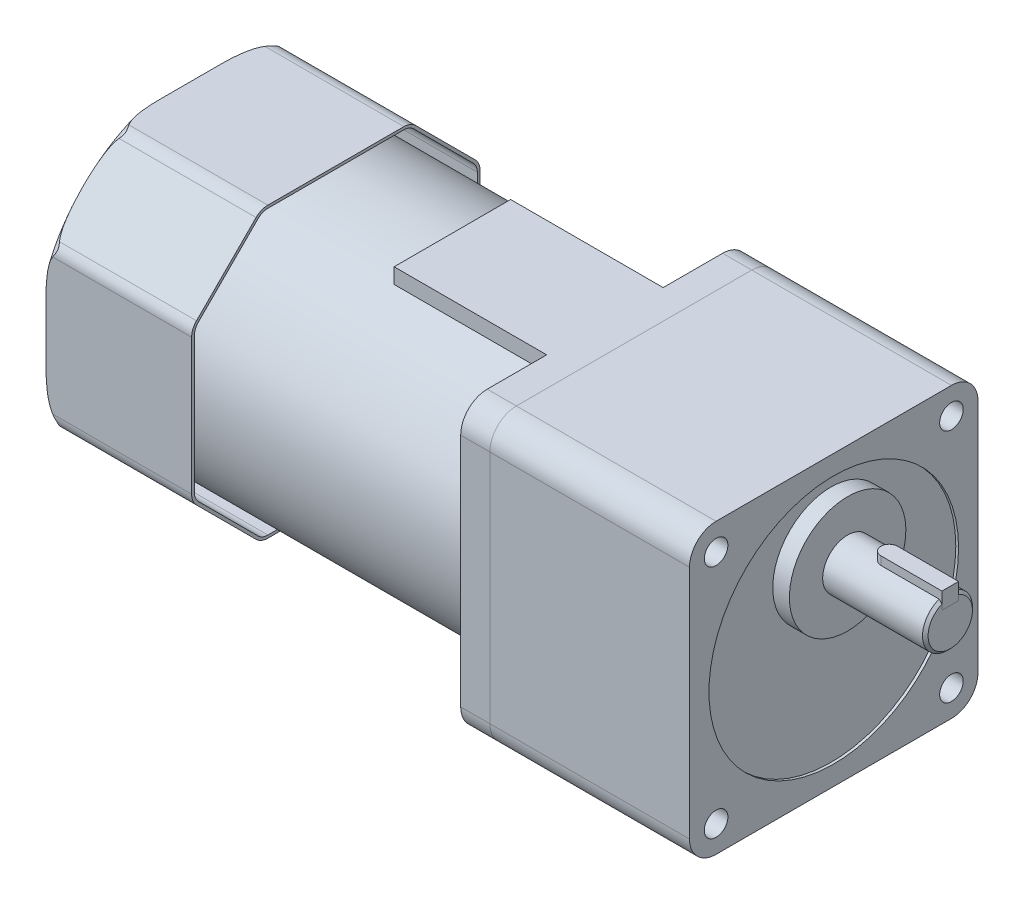
from build123d import *

# Parameters (mm, degrees)
SKETCH1_R                = 4.25
BOSS_EXTRUDE1_DEPTH      = 72
CHAMFER1_SIZE            = 1
BOSS_EXTRUDE2_START      = 31.5
BOSS_EXTRUDE2_DEPTH      = 6
CUT_EXTRUDE1_DEPTH       = 6
CUT_EXTRUDE2_START       = -1
SKETCH5_R                = 45
SKETCH5_R_2              = 21
CUT_EXTRUDE2_DEPTH       = 1
SKETCH6_R                = 4.25
BOSS_EXTRUDE3_DEPTH      = 10.5
BOSS_EXTRUDE4_DEPTH      = 2
BOSS_EXTRUDE4_DEPTH_BACK = 50.5
SHELL1_T                 = -1
SKETCH10_W               = 55
SKETCH10_H               = 42
BOSS_EXTRUDE5_DEPTH      = 11
SKETCH16_R               = 47.5
SKETCH16_R_2             = 40.5
SKETCH16_R_3             = 33.5
SKETCH16_R_4             = 26.5
SKETCH16_R_5             = 19.5
SKETCH16_R_6             = 12.5
CUT_EXTRUDE3_DEPTH       = 1
SKETCH17_W               = 6
SKETCH17_H               = 37.14814695
BOSS_EXTRUDE10_DEPTH     = 1


with BuildPart() as part:
    # Sketch1 → Boss-Extrude1 (new body)
    with BuildSketch(Plane(origin=(0, 0, 0), x_dir=(0, 0, -1), z_dir=(1, 0, 0))):
        with BuildLine():
            Line((-42.426, -52), (42.426, -52))
            ThreePointArc((42.426, -52), (49.195840323, -49.195840323), (52, -42.426))
            Line((52, -42.426), (52, 42.426))
            ThreePointArc((52, 42.426), (49.195840323, 49.195840323), (42.426, 52))
            Line((42.426, 52), (-42.426, 52))
            ThreePointArc((-42.426, 52), (-49.195840323, 49.195840323), (-52, 42.426))
            Line((-52, 42.426), (-52, -42.426))
            ThreePointArc((-52, -42.426), (-49.195840323, -49.195840323), (-42.426, -52))
        make_face()
        with Locations((-42.426406871, -42.426406871)):
            Circle(SKETCH1_R, mode=Mode.SUBTRACT)
        with Locations((-42.426406871, 42.426406871)):
            Circle(SKETCH1_R, mode=Mode.SUBTRACT)
        with Locations((42.426406871, 42.426406871)):
            Circle(SKETCH1_R, mode=Mode.SUBTRACT)
        with Locations((42.426406871, -42.426406871)):
            Circle(SKETCH1_R, mode=Mode.SUBTRACT)
    extrude(amount=BOSS_EXTRUDE1_DEPTH)

    # Sketch2 → Revolve1 (revolve)
    with BuildSketch(Plane.XY):
        Polygon((114, 20), (114, 29), (77, 29), (77, 41), (72, 41), (72, 20), align=None)
    revolve(axis=Axis((72, 20, 0), (1, 0, 0)))

    # Chamfer1
    chamfer1_edges = [part.edges().sort_by_distance(p)[0] for p in [
        (114, 11, 0),
    ]]
    chamfer(chamfer1_edges, length=CHAMFER1_SIZE)

    # Sketch4 → Cut-Extrude1 (cut)
    with BuildSketch(Plane(origin=(0, 31.5, 0), x_dir=(1, 0, 0), z_dir=(0, 1, 0))):
        with BuildLine():
            Line((114, -3), (114, 3))
            Line((114, 3), (92, 3))
            ThreePointArc((92, 3), (89, 0), (92, -3))
            Line((92, -3), (114, -3))
        make_face()
    extrude(amount=-CUT_EXTRUDE1_DEPTH, mode=Mode.SUBTRACT)

    # Sketch5 → Cut-Extrude2 (cut)
    with BuildSketch(Plane(origin=(72, 0, 0), x_dir=(0, 0, -1), z_dir=(1, 0, 0)).offset(CUT_EXTRUDE2_START)):
        Circle(SKETCH5_R)
        with Locations((0, 20)):
            Circle(SKETCH5_R_2, mode=Mode.SUBTRACT)
    extrude(amount=CUT_EXTRUDE2_DEPTH, mode=Mode.SUBTRACT)


with BuildPart() as body_2:
    # Sketch3 → Boss-Extrude2 (new body)
    with BuildSketch(Plane(origin=(0, 0, 0), x_dir=(1, 0, 0), z_dir=(0, 1, 0)).offset(BOSS_EXTRUDE2_START)):
        with BuildLine():
            Line((114, 3), (92, 3))
            ThreePointArc((92, 3), (89, 0), (92, -3))
            Line((92, -3), (114, -3))
            Line((114, -3), (114, 3))
        make_face()
    extrude(amount=-BOSS_EXTRUDE2_DEPTH)


with BuildPart() as body_3:
    # Sketch6 → Boss-Extrude3 (new body)
    with BuildSketch(Plane.ZY):
        with BuildLine():
            Line((52, -42.426), (52, 42.426))
            ThreePointArc((52, 42.426), (49.195840323, 49.195840323), (42.426, 52))
            Line((42.426, 52), (-42.426, 52))
            ThreePointArc((-42.426, 52), (-49.195840323, 49.195840323), (-52, 42.426))
            Line((-52, 42.426), (-52, -42.426))
            ThreePointArc((-52, -42.426), (-49.195840323, -49.195840323), (-42.426, -52))
            Line((-42.426, -52), (42.426, -52))
            ThreePointArc((42.426, -52), (49.195840323, -49.195840323), (52, -42.426))
        make_face()
        with Locations((42.426406871, 42.426406871)):
            Circle(SKETCH6_R, mode=Mode.SUBTRACT)
        with Locations((-42.426406871, 42.426406871)):
            Circle(SKETCH6_R, mode=Mode.SUBTRACT)
        with Locations((-42.426406871, -42.426406871)):
            Circle(SKETCH6_R, mode=Mode.SUBTRACT)
        with Locations((42.426406871, -42.426406871)):
            Circle(SKETCH6_R, mode=Mode.SUBTRACT)
    extrude(amount=BOSS_EXTRUDE3_DEPTH)

    # Sketch7 → Revolve2 (revolve)
    with BuildSketch(Plane.XY):
        with BuildLine():
            Line((-158, 0), (-158, 44))
            ThreePointArc((-158, 44), (-156.535533906, 47.535533906), (-153, 49))
            Line((-153, 49), (-148.5, 49))
            Line((-148.5, 49), (-148.5, 51))
            Line((-148.5, 51), (-10.5, 51))
            Line((-10.5, 51), (-10.5, 0))
            Line((-10.5, 0), (-158, 0))
        make_face()
    revolve(axis=Axis((-10.5, 0, 0), (-1, 0, 0)))

    # Sketch10 → Boss-Extrude5 (add)
    with BuildSketch(Plane(origin=(0, 52, 0), x_dir=(1, 0, 0), z_dir=(0, 1, 0))):
        with Locations((-38, 0)):
            Rectangle(SKETCH10_W, SKETCH10_H)
    extrude(amount=-BOSS_EXTRUDE5_DEPTH)


with BuildPart() as body_4:
    # Sketch8 → Boss-Extrude4 (new, two sides: drawn at the far end of the back side and taken through both)
    with BuildSketch(Plane.ZY.offset(158).offset(-BOSS_EXTRUDE4_DEPTH_BACK)):
        with BuildLine():
            Line((28.757359313, 50.242640687), (50.242640687, 28.757359313))
            ThreePointArc((50.242640687, 28.757359313), (51.543277195, 26.81081922), (52, 24.514718626))
            Line((52, 24.514718626), (52, -24.514718626))
            ThreePointArc((52, -24.514718626), (51.543277195, -26.81081922), (50.242640687, -28.757359313))
            Line((50.242640687, -28.757359313), (28.757359313, -50.242640687))
            ThreePointArc((28.757359313, -50.242640687), (26.81081922, -51.543277195), (24.514718626, -52))
            Line((24.514718626, -52), (-24.514718626, -52))
            ThreePointArc((-24.514718626, -52), (-26.81081922, -51.543277195), (-28.757359313, -50.242640687))
            Line((-28.757359313, -50.242640687), (-50.242640687, -28.757359313))
            ThreePointArc((-50.242640687, -28.757359313), (-51.543277195, -26.81081922), (-52, -24.514718626))
            Line((-52, -24.514718626), (-52, 24.514718626))
            ThreePointArc((-52, 24.514718626), (-51.543277195, 26.81081922), (-50.242640687, 28.757359313))
            Line((-50.242640687, 28.757359313), (-28.757359313, 50.242640687))
            ThreePointArc((-28.757359313, 50.242640687), (-26.81081922, 51.543277195), (-24.514718626, 52))
            Line((-24.514718626, 52), (24.514718626, 52))
            ThreePointArc((24.514718626, 52), (26.81081922, 51.543277195), (28.757359313, 50.242640687))
        make_face()
    extrude(amount=BOSS_EXTRUDE4_DEPTH + BOSS_EXTRUDE4_DEPTH_BACK)

    # Sketch9 → Cut-Revolve1 (revolve, cut)
    with BuildSketch(Plane.XY):
        with BuildLine():
            Line((-160, 53), (-160, 58.403446364))
            Line((-160, 58.403446364), (-154.596553636, 58.403446364))
            ThreePointArc((-154.596553636, 58.403446364), (-158.417367202, 56.820813566), (-160, 53))
        make_face()
    revolve(axis=Axis((0, 0, 0), (-1, 0, 0)), mode=Mode.SUBTRACT)

    # Shell1
    shell1_openings = [body_4.faces().sort_by_distance(p)[0] for p in [
        (-107.5, 0, 0),
    ]]
    offset(amount=SHELL1_T, openings=shell1_openings)

    # Sketch16 → Cut-Extrude3 (cut)
    # profile 1 of 3: a face of its own
    with BuildSketch(Plane.ZY.offset(160)):
        Circle(SKETCH16_R)
        Circle(SKETCH16_R_2, mode=Mode.SUBTRACT)
    # profile 2 of 3: a face of its own
    with BuildSketch(Plane.ZY.offset(160)):
        Circle(SKETCH16_R_3)
        Circle(SKETCH16_R_4, mode=Mode.SUBTRACT)
    # profile 3 of 3: a face of its own
    with BuildSketch(Plane.ZY.offset(160)):
        Circle(SKETCH16_R_5)
        Circle(SKETCH16_R_6, mode=Mode.SUBTRACT)
    extrude(amount=-CUT_EXTRUDE3_DEPTH, mode=Mode.SUBTRACT)


with BuildPart() as cut_extrude3_piece_1:
    # of the separate pieces the step leaves, piece 1, a body of its own (cut_extrude3_pieces)
    add(body_4.part.solids().sort_by_distance((-107.5, 50.242640687, 28.757359313))[0])



with BuildPart() as cut_extrude3_piece_2:
    # of the separate pieces the step leaves, piece 2, a body of its own (cut_extrude3_pieces)
    add(body_4.part.solids().sort_by_distance((-160, 0, 40.5))[0])


with BuildPart() as cut_extrude3_piece_3:
    # of the separate pieces the step leaves, piece 3, a body of its own (cut_extrude3_pieces)
    add(body_4.part.solids().sort_by_distance((-160, 0, 26.5))[0])


with BuildPart() as cut_extrude3_piece_4:
    # of the separate pieces the step leaves, piece 4, a body of its own (cut_extrude3_pieces)
    add(body_4.part.solids().sort_by_distance((-160, 0, 12.5))[0])


with BuildPart() as cut_extrude3_piece_1_1:
    add(cut_extrude3_piece_1.part)

    add(cut_extrude3_piece_2.part)  # Boss-Extrude10 merges Cut-Extrude3 piece 2

    add(cut_extrude3_piece_3.part)  # Boss-Extrude10 merges Cut-Extrude3 piece 3

    add(cut_extrude3_piece_4.part)  # Boss-Extrude10 merges Cut-Extrude3 piece 4
    # Sketch17 → Boss-Extrude10 (add)
    with BuildSketch(Plane.ZY.offset(160)):
        with Locations((0, 29.95086867)):
            Rectangle(SKETCH17_W, SKETCH17_H)
        Polygon((11.352593653, 3.090321386), (43.523832615, 21.664394861), (40.523832615, 26.860547284), (8.352593653, 8.286473809), align=None)
        Polygon((8.352593653, -8.286473809), (40.523832615, -26.860547284), (43.523832615, -21.664394861), (11.352593653, -3.090321386), align=None)
        with Locations((0, -29.95086867)):
            Rectangle(SKETCH17_W, SKETCH17_H)
        Polygon((-11.352593653, -3.090321386), (-43.523832615, -21.664394861), (-40.523832615, -26.860547284), (-8.352593653, -8.286473809), align=None)
        Polygon((-8.352593653, 8.286473809), (-40.523832615, 26.860547284), (-43.523832615, 21.664394861), (-11.352593653, 3.090321386), align=None)
    extrude(amount=-BOSS_EXTRUDE10_DEPTH)


solid = Compound([part.part, body_2.part, body_3.part, cut_extrude3_piece_1_1.part])
